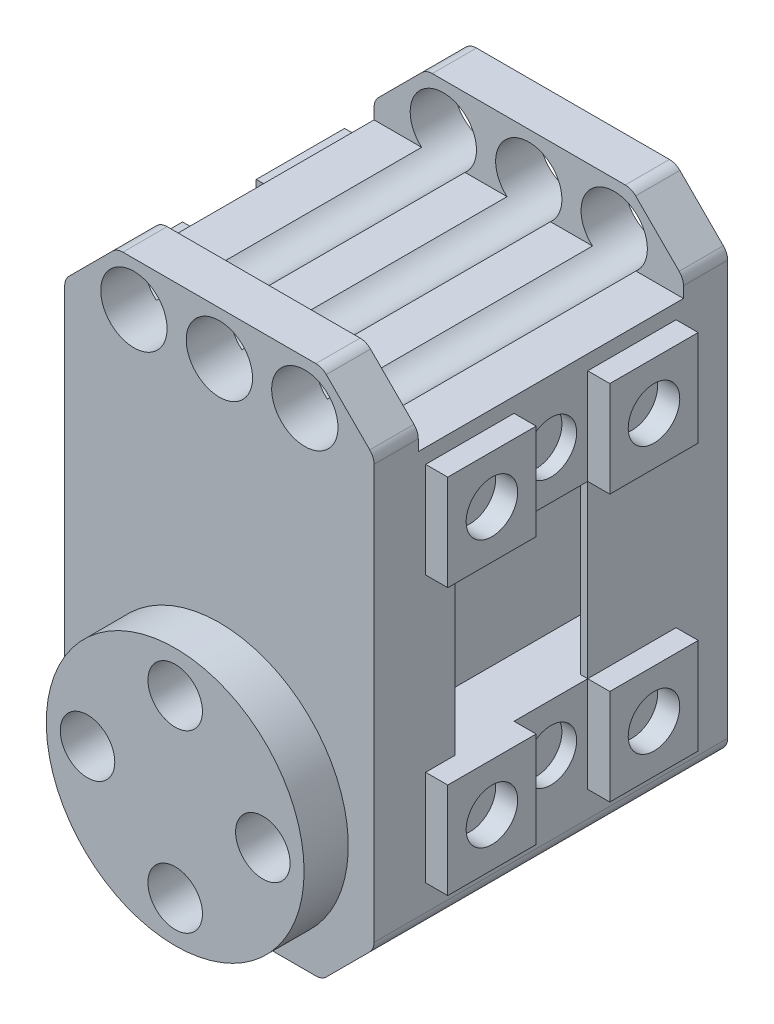
from build123d import *

# Parameters (mm, degrees)
BOSS_EXTRU_1_DEPTH           = 24
CONG_1_R                     = 1
ESQUISSE2_W                  = 6
ESQUISSE2_H                  = 6.5
ESQUISSE2_R                  = 1.75
BOSS_EXTRU_2_DEPTH           = 1.5
ENL_V_MAT_EXTRU_1_DEPTH      = 45.775212404
ENL_V_MAT_EXTRU_1_DEPTH_BACK = 45.775212404
ESQUISSE4_W                  = 18
ESQUISSE4_H                  = 4.7
ESQUISSE5_R                  = 2.25
ENL_V_MAT_EXTRU_2_DEPTH      = 49.494179566
ESQUISSE6_W                  = 9
ESQUISSE6_H                  = 11.6
ENL_V_MAT_EXTRU_3_DEPTH      = 4
ESQUISSE7_R                  = 1.75
ENL_V_MAT_EXTRU_4_DEPTH      = 1
ESQUISSE8_R                  = 8.75
ESQUISSE8_R_2                = 1.85
BOSS_EXTRU_3_DEPTH           = 3
ESQUISSE9_W                  = 3.5
ESQUISSE9_H                  = 11.6
ENL_V_MAT_EXTRU_5_DEPTH      = 4.5
ESQUISSE10_R                 = 2.25
ENL_V_MAT_EXTRU_6_DEPTH      = 3


with BuildPart() as part:
    # Esquisse1 → Boss.-Extru.1 (new body)
    with BuildSketch(Plane.XY):
        Polygon((3.191025459, -0.155619048), (-0.344508447, 3.379914858), (-0.344508447, 32.308847046), (3.191025459, 35.844380952), (17.119957647, 35.844380952), (20.655491553, 32.308847046), (20.655491553, 3.379914858), (17.119957647, -0.155619048), align=None)
    extrude(amount=BOSS_EXTRU_1_DEPTH)

    # Congé1
    cong_1_edges = [part.edges().sort_by_distance(p)[0] for p in [
        (3.191025459, -0.155619048, 12),
        (-0.344508447, 3.379914858, 12),
        (-0.344508447, 32.308847046, 12),
        (3.191025459, 35.844380952, 12),
        (17.119957647, 35.844380952, 12),
        (20.655491553, 32.308847046, 12),
        (20.655491553, 3.379914858, 12),
        (17.119957647, -0.155619048, 12),
    ]]
    fillet(cong_1_edges, radius=CONG_1_R)

    # Esquisse2 → Boss.-Extru.2 (add)
    # profile 1 of 4: a face of its own
    with BuildSketch(Plane(origin=(20.655491553, 0, 0), x_dir=(0, 0, -1), z_dir=(1, 0, 0))):
        with Locations((-17.5, 8.794380952)):
            Rectangle(ESQUISSE2_W, ESQUISSE2_H)
        with Locations(Location((-17.5, 8.794380952, 0), (0, 0, 90))):
            Circle(ESQUISSE2_R, mode=Mode.SUBTRACT)
    # profile 2 of 4: a face of its own
    with BuildSketch(Plane(origin=(20.655491553, 0, 0), x_dir=(0, 0, -1), z_dir=(1, 0, 0))):
        with Locations((-6.5, 8.794380952)):
            Rectangle(ESQUISSE2_W, ESQUISSE2_H)
        with Locations(Location((-6.5, 8.794380952, 0), (0, 0, 90))):
            Circle(ESQUISSE2_R, mode=Mode.SUBTRACT)
    # profile 3 of 4: a face of its own
    with BuildSketch(Plane(origin=(20.655491553, 0, 0), x_dir=(0, 0, -1), z_dir=(1, 0, 0))):
        with Locations((-17.5, 26.894380952)):
            Rectangle(ESQUISSE2_W, ESQUISSE2_H)
        with Locations(Location((-17.5, 26.894380952, 0), (0, 0, 90))):
            Circle(ESQUISSE2_R, mode=Mode.SUBTRACT)
    # profile 4 of 4: a face of its own
    with BuildSketch(Plane(origin=(20.655491553, 0, 0), x_dir=(0, 0, -1), z_dir=(1, 0, 0))):
        with Locations((-6.5, 26.894380952)):
            Rectangle(ESQUISSE2_W, ESQUISSE2_H)
        with Locations(Location((-6.5, 26.894380952, 0), (0, 0, 90))):
            Circle(ESQUISSE2_R, mode=Mode.SUBTRACT)
    boss_extru_2 = extrude(amount=BOSS_EXTRU_2_DEPTH)

    # Symétrie1: Boss.-Extru.2 across plane
    add(boss_extru_2.mirror(Plane(origin=(10.155491553, 0, 0), x_dir=(0, 0, 1), z_dir=(1, 0, 0))))

    # Esquisse4 → Enlèv. mat.-Extru.1 (cut, two sides: drawn at the far end of the back side and taken through both)
    with BuildSketch(Plane(origin=(10.155491553, 0, 0), x_dir=(0, 0, -1), z_dir=(1, 0, 0)).offset(-ENL_V_MAT_EXTRU_1_DEPTH_BACK)):
        with Locations((-12, 33.494380952)):
            Rectangle(ESQUISSE4_W, ESQUISSE4_H)
    extrude(amount=ENL_V_MAT_EXTRU_1_DEPTH + ENL_V_MAT_EXTRU_1_DEPTH_BACK, mode=Mode.SUBTRACT)

    # Esquisse5 → Enlèv. mat.-Extru.2 (cut, through all)
    with BuildSketch(Plane.XY.offset(24)):
        with Locations((4.355491553, 32.844380952)):
            Circle(ESQUISSE5_R)
        with Locations((10.155491553, 32.844380952)):
            Circle(ESQUISSE5_R)
        with Locations((15.955491553, 32.844380952)):
            Circle(ESQUISSE5_R)
    extrude(amount=-ENL_V_MAT_EXTRU_2_DEPTH, mode=Mode.SUBTRACT)

    # Esquisse6 → Enlèv. mat.-Extru.3 (cut)
    with BuildSketch(Plane(origin=(20.655491553, 0, 0), x_dir=(0, 0, -1), z_dir=(1, 0, 0))):
        with Locations((-14, 17.844380952)):
            Rectangle(ESQUISSE6_W, ESQUISSE6_H)
    enl_v_mat_extru_3 = extrude(amount=-ENL_V_MAT_EXTRU_3_DEPTH, mode=Mode.SUBTRACT)

    # Symétrie2: Enlèv. mat.-Extru.3 across plane
    add(enl_v_mat_extru_3.mirror(Plane(origin=(10.155491553, 0, 0), x_dir=(0, 0, 1), z_dir=(1, 0, 0))), mode=Mode.SUBTRACT)

    # Esquisse7 → Enlèv. mat.-Extru.4 (cut)
    with BuildSketch(Plane(origin=(20.655491553, 0, 0), x_dir=(0, 0, -1), z_dir=(1, 0, 0))):
        with Locations(Location((-12, 8.794380952, 0), (0, 0, 90))):
            Circle(ESQUISSE7_R)
        with Locations(Location((-12, 26.894380952, 0), (0, 0, 90))):
            Circle(ESQUISSE7_R)
    enl_v_mat_extru_4 = extrude(amount=-ENL_V_MAT_EXTRU_4_DEPTH, mode=Mode.SUBTRACT)

    # Symétrie3: Enlèv. mat.-Extru.4 across plane
    add(enl_v_mat_extru_4.mirror(Plane(origin=(10.155491553, 0, 0), x_dir=(0, 0, 1), z_dir=(1, 0, 0))), mode=Mode.SUBTRACT)

    # Esquisse8 → Boss.-Extru.3 (add)
    with BuildSketch(Plane.XY.offset(24)):
        with Locations(Location((10.155491553, 8.594380952, 0), (0, 0, 270))):
            Circle(ESQUISSE8_R)
        with Locations((10.155491553, 2.644380952)):
            Circle(ESQUISSE8_R_2, mode=Mode.SUBTRACT)
        with Locations((4.205491553, 8.594380952)):
            Circle(ESQUISSE8_R_2, mode=Mode.SUBTRACT)
        with Locations((10.155491553, 14.544380952)):
            Circle(ESQUISSE8_R_2, mode=Mode.SUBTRACT)
        with Locations((16.105491553, 8.594380952)):
            Circle(ESQUISSE8_R_2, mode=Mode.SUBTRACT)
    extrude(amount=BOSS_EXTRU_3_DEPTH)

    # Esquisse9 → Enlèv. mat.-Extru.5 (cut)
    with BuildSketch(Plane.XY.offset(9.5)):
        with Locations((18.405491553, 17.844380952)):
            Rectangle(ESQUISSE9_W, ESQUISSE9_H)
    enl_v_mat_extru_5 = extrude(amount=-ENL_V_MAT_EXTRU_5_DEPTH, mode=Mode.SUBTRACT)

    # Symétrie4: Enlèv. mat.-Extru.5 across plane
    add(enl_v_mat_extru_5.mirror(Plane(origin=(10.155491553, 0, 0), x_dir=(0, 0, 1), z_dir=(1, 0, 0))), mode=Mode.SUBTRACT)

    # Esquisse10 → Enlèv. mat.-Extru.6 (cut)
    with BuildSketch(Plane(origin=(0, 0, 0), x_dir=(-1, 0, 0), z_dir=(0, 0, -1))):
        with Locations((-10.155491553, 8.694380952)):
            Circle(ESQUISSE10_R)
        with Locations((-15.955491553, 8.694380952)):
            Circle(ESQUISSE10_R)
        with Locations((-4.355491553, 8.694380952)):
            Circle(ESQUISSE10_R)
    extrude(amount=-ENL_V_MAT_EXTRU_6_DEPTH, mode=Mode.SUBTRACT)


solid = part.part
